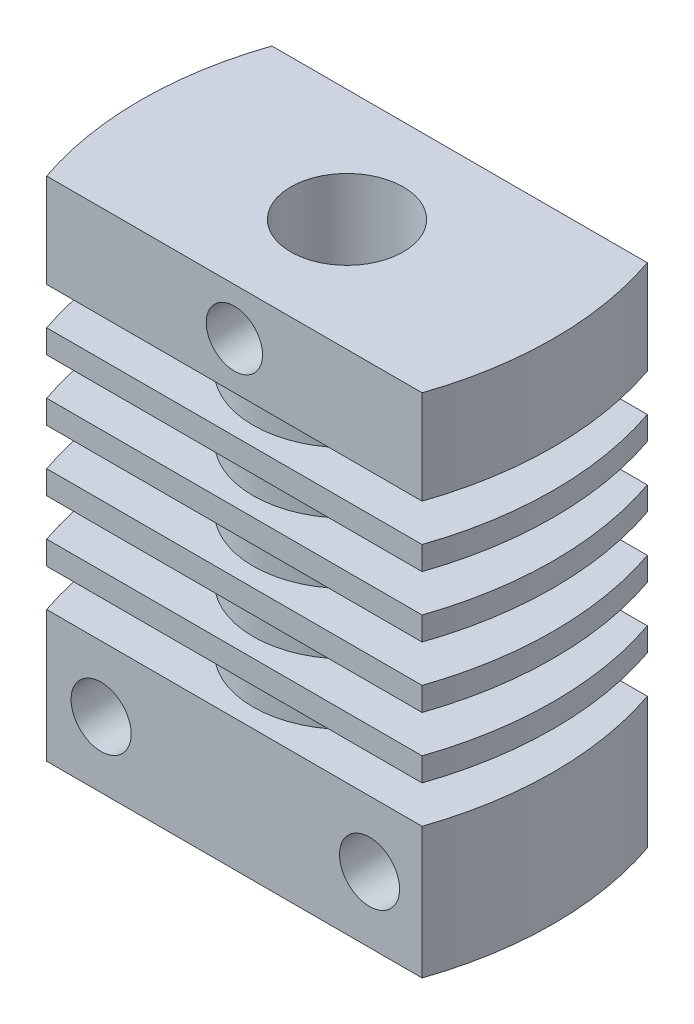
from build123d import *

# Parameters (mm, degrees)
EXTRUDE_1_DEPTH        = 7
SKETCH_2_R             = 5
EXTRUDE_2_DEPTH        = 15
EXTRUDE_3_DEPTH        = 1.25
PATTERN_LINEAR_1_COUNT = 4
PATTERN_LINEAR_1_PITCH = 3.25
EXTRUDE_5_DEPTH        = 5
SKETCH_8_R             = 1.6
CUT_EXTRUDE_2_DEPTH    = 33.583240961
SKETCH_9_R             = 1.5
CUT_EXTRUDE_3_DEPTH    = 5
SKETCH_10_R            = 3
CUT_EXTRUDE_4_DEPTH    = 32.373048931


with BuildPart() as part:
    # 草图1 → 凸台-拉伸1 (new body)
    with BuildSketch(Plane(origin=(0, 0, 0), x_dir=(1, 0, 0), z_dir=(0, 1, 0))):
        with BuildLine():
            Line((-7.264367816, 3.83908046), (12.735632184, 3.83908046))
            ThreePointArc((12.735632184, 3.83908046), (13.735632184, -2.16091954), (12.735632184, -8.16091954))
            Line((12.735632184, -8.16091954), (-7.264367816, -8.16091954))
            ThreePointArc((-7.264367816, -8.16091954), (-8.264367816, -2.16091954), (-7.264367816, 3.83908046))
        make_face()
    extrude(amount=EXTRUDE_1_DEPTH)

    # 草图2 → 凸台-拉伸2 (add)
    with BuildSketch(Plane(origin=(0, 7, 0), x_dir=(1, 0, 0), z_dir=(0, 1, 0))):
        with Locations(Location((2.735632184, -2.16091954, 0), (0, 0, 270))):
            Circle(SKETCH_2_R)
    extrude(amount=EXTRUDE_2_DEPTH)

    # 草图4 → 凸台-拉伸3 (add)
    with BuildSketch(Plane(origin=(0, 9, 0), x_dir=(1, 0, 0), z_dir=(0, 1, 0))):
        with BuildLine():
            Line((-7.264367816, -8.16091954), (12.735632184, -8.16091954))
            ThreePointArc((12.735632184, -8.16091954), (13.735632184, -2.16091954), (12.735632184, 3.83908046))
            Line((12.735632184, 3.83908046), (-7.264367816, 3.83908046))
            ThreePointArc((-7.264367816, 3.83908046), (-8.264367816, -2.16091954), (-7.264367816, -8.16091954))
        make_face()
    extrude_3 = extrude(amount=EXTRUDE_3_DEPTH)

    # 阵列(线性)1: 凸台-拉伸3 ×4
    with Locations(*[(0, i * PATTERN_LINEAR_1_PITCH, 0) for i in range(1, PATTERN_LINEAR_1_COUNT)]):
        add(extrude_3)

    # 草图6 → 凸台-拉伸5 (add)
    with BuildSketch(Plane(origin=(0, 22, 0), x_dir=(1, 0, 0), z_dir=(0, 1, 0))):
        with BuildLine():
            Line((12.735632184, 3.83908046), (-7.264367816, 3.83908046))
            ThreePointArc((-7.264367816, 3.83908046), (-8.264367816, -2.16091954), (-7.264367816, -8.16091954))
            Line((-7.264367816, -8.16091954), (12.735632184, -8.16091954))
            ThreePointArc((12.735632184, -8.16091954), (13.735632184, -2.16091954), (12.735632184, 3.83908046))
        make_face()
    extrude(amount=EXTRUDE_5_DEPTH)

    # 草图8 → 切除-拉伸2 (cut, through all)
    with BuildSketch(Plane.XY.offset(8.16091954)):
        with Locations((-4.364367816, 3.5)):
            Circle(SKETCH_8_R)
        with Locations((9.935632184, 3.5)):
            Circle(SKETCH_8_R)
    extrude(amount=-CUT_EXTRUDE_2_DEPTH, mode=Mode.SUBTRACT)

    # 草图9 → 切除-拉伸3 (cut)
    with BuildSketch(Plane.XY.offset(8.16091954)):
        with Locations((2.735632184, 24.5)):
            Circle(SKETCH_9_R)
    extrude(amount=-CUT_EXTRUDE_3_DEPTH, mode=Mode.SUBTRACT)

    # 草图10 → 切除-拉伸4 (cut, through all)
    with BuildSketch(Plane.XZ):
        with Locations(Location((2.735995225, 2.16091954, 0), (0, 0, 270))):
            Circle(SKETCH_10_R)
    extrude(amount=-CUT_EXTRUDE_4_DEPTH, mode=Mode.SUBTRACT)


solid = part.part
